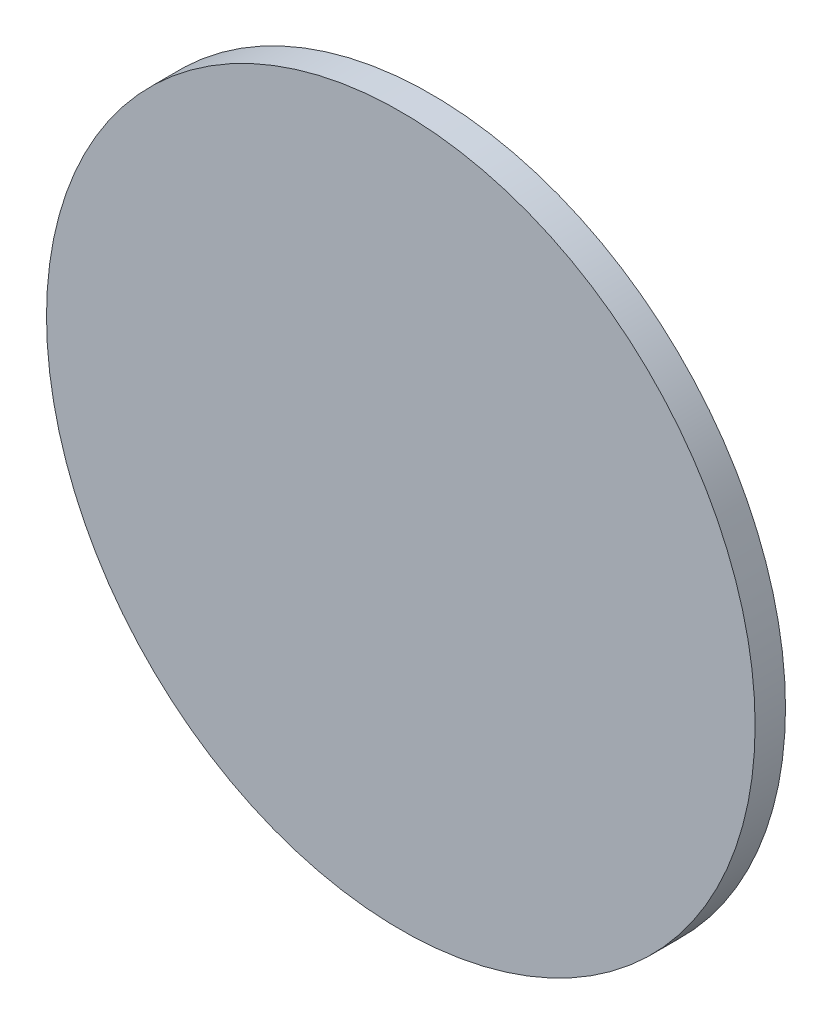
from build123d import *

# Parameters (mm, degrees)
SKETCH1_R           = 44.45
BOSS_EXTRUDE1_DEPTH = 3.81


with BuildPart() as part:
    # Sketch1 → Boss-Extrude1 (new body)
    with BuildSketch(Plane.XY):
        with Locations(Location((0, 0, 0), (0, 0, 180))):
            Circle(SKETCH1_R)
    extrude(amount=BOSS_EXTRUDE1_DEPTH)


solid = part.part
